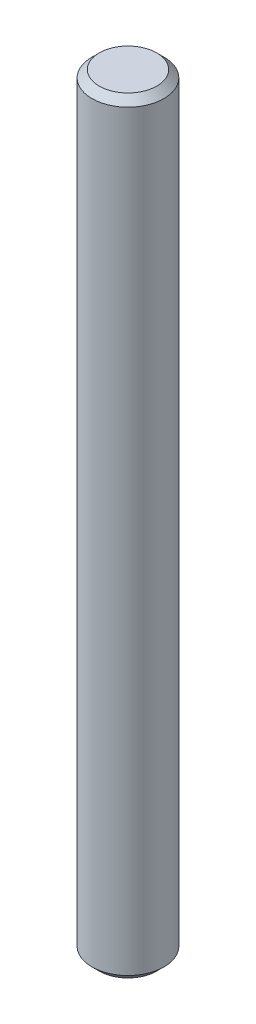
from build123d import *

# Parameters (mm, degrees)
BOSS_EXTRUDE1_DEPTH      = 10
BOSS_EXTRUDE1_DEPTH_BACK = 0.65
SKETCH1_R                = 0.5
CHAMFER1_SIZE            = 0.1


with BuildPart() as part:
    # Sketch1 → Boss-Extrude1 (new, two sides: drawn at the far end of the back side and taken through both)
    with BuildSketch(Plane(origin=(0, 0, 0), x_dir=(1, 0, 0), z_dir=(0, 1, 0)).offset(-BOSS_EXTRUDE1_DEPTH_BACK)):
        with Locations(Location((0, 0, 0), (0, 0, 270))):
            Circle(SKETCH1_R)
    extrude(amount=BOSS_EXTRUDE1_DEPTH + BOSS_EXTRUDE1_DEPTH_BACK)

    # Chamfer1
    chamfer1_edges = [part.edges().sort_by_distance(p)[0] for p in [
        (0, -0.65, -0.5),
        (0, 10, -0.5),
    ]]
    chamfer(chamfer1_edges, length=CHAMFER1_SIZE)


solid = part.part
